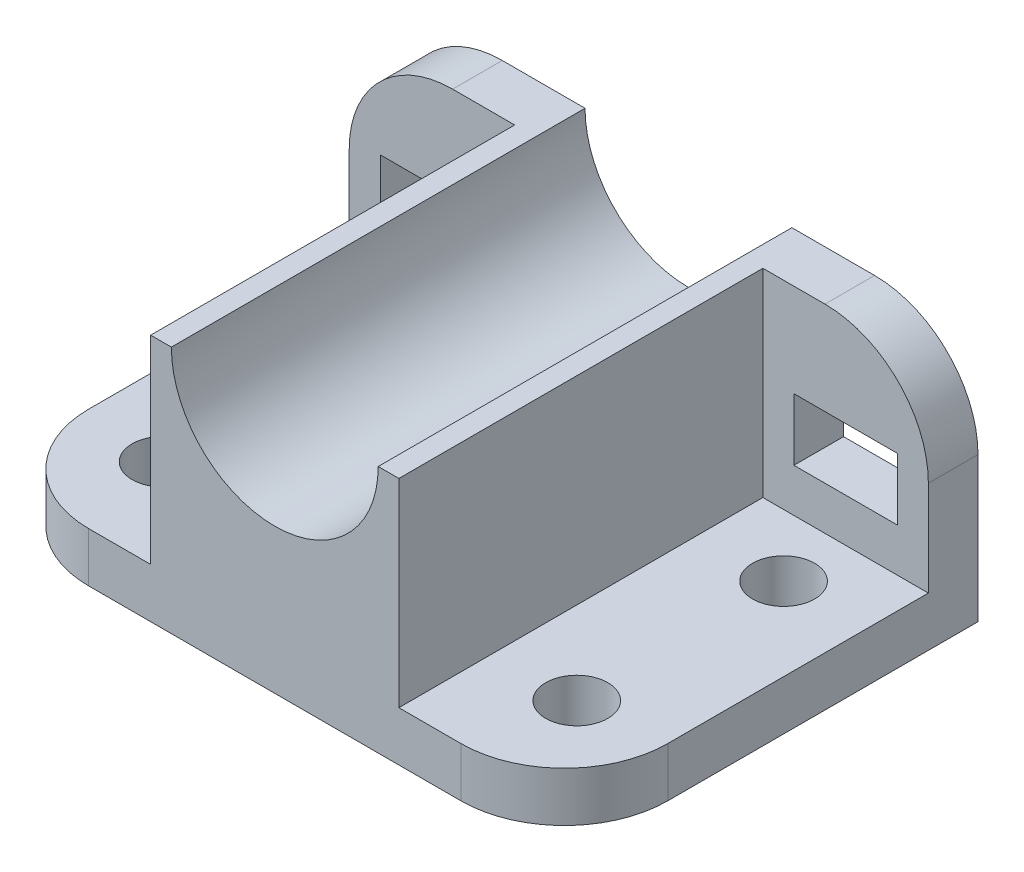
from build123d import *

# Parameters (mm, degrees)
SKETCH2_W              = 25
SKETCH2_H              = 15
BOSS_EXTRUDE1_DEPTH    = 100
SKETCH3_W              = 40
SKETCH3_H              = 48
SKETCH3_W_2            = 25
SKETCH3_H_2            = 15
CUT_EXTRUDE1_DEPTH     = 88
F_12_0MM_DOWEL_HOLE1_D = 15
FILLET1_R              = 25


with BuildPart() as part:
    # Sketch2 → Boss-Extrude1 (new body)
    with BuildSketch(Plane.XY):
        with BuildLine():
            Line((-70, 0), (70, 0))
            Line((70, 0), (70, 60))
            Line((70, 60), (25, 60))
            ThreePointArc((25, 60), (0, 35), (-25, 60))
            Line((-25, 60), (-70, 60))
            Line((-70, 60), (-70, 0))
        make_face()
        with Locations((50, 30)):
            Rectangle(SKETCH2_W, SKETCH2_H, mode=Mode.SUBTRACT)
        with Locations((-50, 30)):
            Rectangle(SKETCH2_W, SKETCH2_H, mode=Mode.SUBTRACT)
    extrude(amount=BOSS_EXTRUDE1_DEPTH)

    # Sketch3 → Cut-Extrude1 (cut)
    # profile 1 of 2: a face of its own
    with BuildSketch(Plane.XY.offset(100)):
        with Locations((-50, 36)):
            Rectangle(SKETCH3_W, SKETCH3_H)
        with Locations((-50, 30)):
            Rectangle(SKETCH3_W_2, SKETCH3_H_2, mode=Mode.SUBTRACT)
    # profile 2 of 2: a face of its own
    with BuildSketch(Plane.XY.offset(100)):
        with Locations((50, 36)):
            Rectangle(SKETCH3_W, SKETCH3_H)
        with Locations((50, 30)):
            Rectangle(SKETCH3_W_2, SKETCH3_H_2, mode=Mode.SUBTRACT)
    extrude(amount=-CUT_EXTRUDE1_DEPTH, mode=Mode.SUBTRACT)

    # Ø12.0mm Dowel Hole1 (through all)
    with Locations(Plane(origin=(0, 12, 0), x_dir=(1, 0, 0), z_dir=(0, 1, 0))):
        with Locations((-50, -27), (-50, -77), (50, -77), (50, -27)):
            Hole(F_12_0MM_DOWEL_HOLE1_D / 2)

    # Fillet1
    fillet1_edges = [part.edges().sort_by_distance(p)[0] for p in [
        (70, 6, 100),
        (-70, 60, 6),
        (70, 60, 6),
        (-70, 6, 100),
    ]]
    fillet(fillet1_edges, radius=FILLET1_R)


solid = part.part
